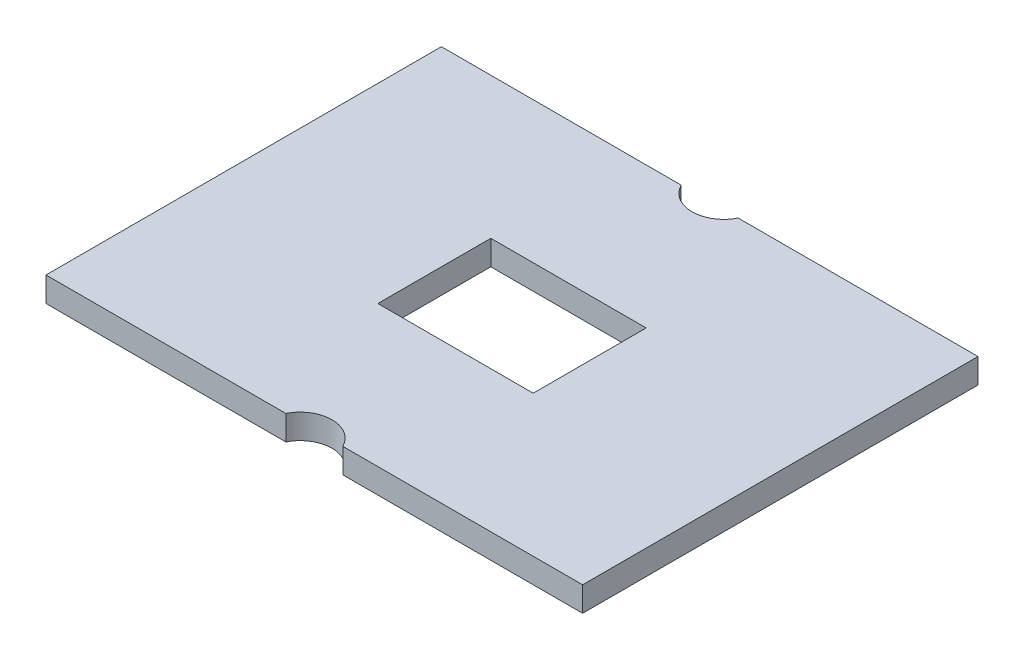
from build123d import *

# Parameters (mm, degrees)
SKETCH1_W           = 76
SKETCH1_H           = 56
BOSS_EXTRUDE1_DEPTH = 3.5
SKETCH2_R           = 4.5
SKETCH2_W           = 22
SKETCH2_H           = 16
CUT_EXTRUDE1_DEPTH  = 3.5


with BuildPart() as part:
    # Sketch1 → Boss-Extrude1 (new body)
    with BuildSketch(Plane(origin=(0, 0, 0), x_dir=(1, 0, 0), z_dir=(0, 1, 0))):
        Rectangle(SKETCH1_W, SKETCH1_H)
    extrude(amount=BOSS_EXTRUDE1_DEPTH)

    # Sketch2 → Cut-Extrude1 (cut)
    with BuildSketch(Plane.XZ):
        with Locations((0, -30)):
            Circle(SKETCH2_R)
        with Locations((0, 30)):
            Circle(SKETCH2_R)
        Rectangle(SKETCH2_W, SKETCH2_H)
    extrude(amount=-CUT_EXTRUDE1_DEPTH, mode=Mode.SUBTRACT)


solid = part.part
